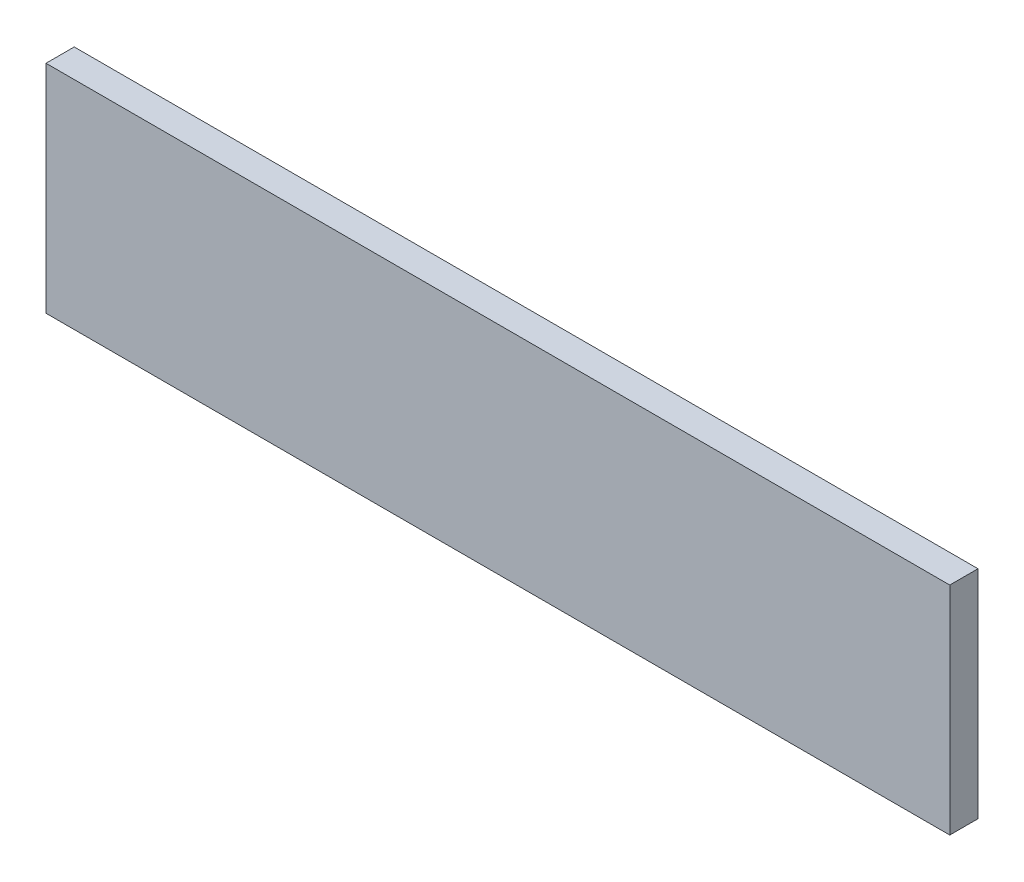
from build123d import *

# Parameters (mm, degrees)
SKETCH1_W           = 609.6
SKETCH1_H           = 146.05
BOSS_EXTRUDE1_DEPTH = 19.05


with BuildPart() as part:
    # Sketch1 → Boss-Extrude1 (new body)
    with BuildSketch(Plane.XY):
        Rectangle(SKETCH1_W, SKETCH1_H)
    extrude(amount=BOSS_EXTRUDE1_DEPTH)


solid = part.part
